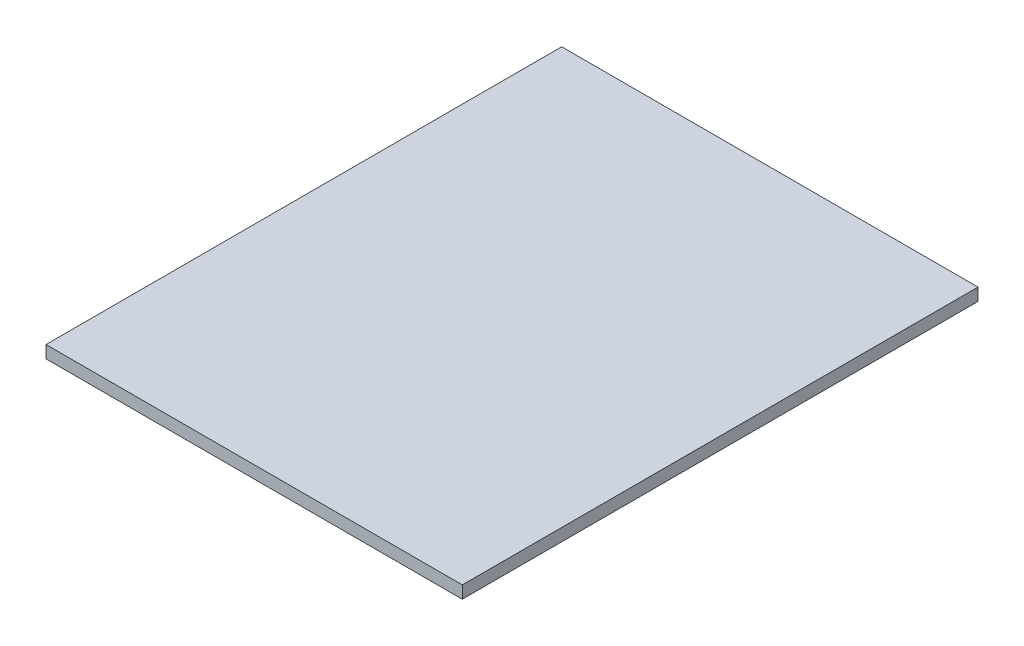
from build123d import *

# Parameters (mm, degrees)
SKETCH1_W           = 67
SKETCH1_H           = 83
BOSS_EXTRUDE1_DEPTH = 2


with BuildPart() as part:
    # Sketch1 → Boss-Extrude1 (new body)
    with BuildSketch(Plane(origin=(0, 0, 0), x_dir=(1, 0, 0), z_dir=(0, 1, 0))):
        Rectangle(SKETCH1_W, SKETCH1_H)
    extrude(amount=BOSS_EXTRUDE1_DEPTH)


solid = part.part
